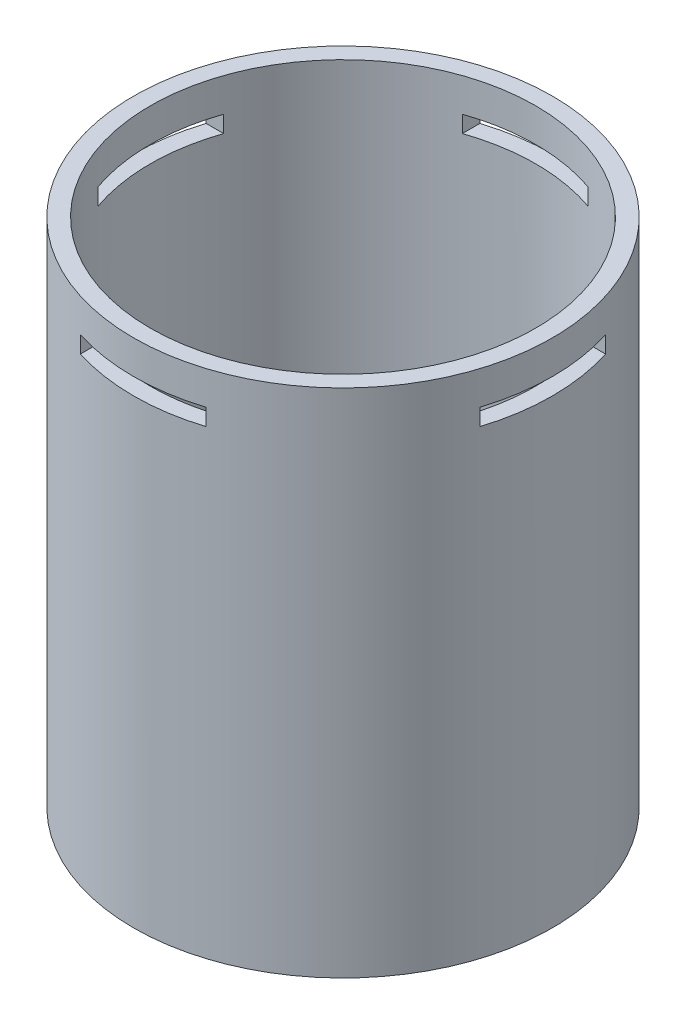
from build123d import *

# Parameters (mm, degrees)
SKETCH1_R           = 25
SKETCH1_R_2         = 23
BOSS_EXTRUDE1_DEPTH = 61
SKETCH2_W           = 15
SKETCH2_H           = 2
CUT_EXTRUDE2_DEPTH  = 26
CIRPATTERN1_COUNT   = 4


with BuildPart() as part:
    # Sketch1 → Boss-Extrude1 (new body)
    with BuildSketch(Plane(origin=(0, 0, 0), x_dir=(1, 0, 0), z_dir=(0, 1, 0))):
        with Locations(Location((0, 0, 0), (0, 0, 90))):
            Circle(SKETCH1_R)
        with Locations(Location((0, 0, 0), (0, 0, 90))):
            Circle(SKETCH1_R_2, mode=Mode.SUBTRACT)
    extrude(amount=BOSS_EXTRUDE1_DEPTH)

    # Sketch2 → Cut-Extrude2 (cut)
    with BuildSketch(Plane.XY):
        with Locations((0, 56)):
            Rectangle(SKETCH2_W, SKETCH2_H)
    cut_extrude2 = extrude(amount=-CUT_EXTRUDE2_DEPTH, mode=Mode.SUBTRACT)

    # CirPattern1: Cut-Extrude2 ×4 about axis
    cirpattern1_axis = Axis((0, 0, 0), (0, 1, 0))
    for i in range(1, CIRPATTERN1_COUNT):
        add(cut_extrude2.rotate(cirpattern1_axis, i * 360 / CIRPATTERN1_COUNT), mode=Mode.SUBTRACT)


solid = part.part
